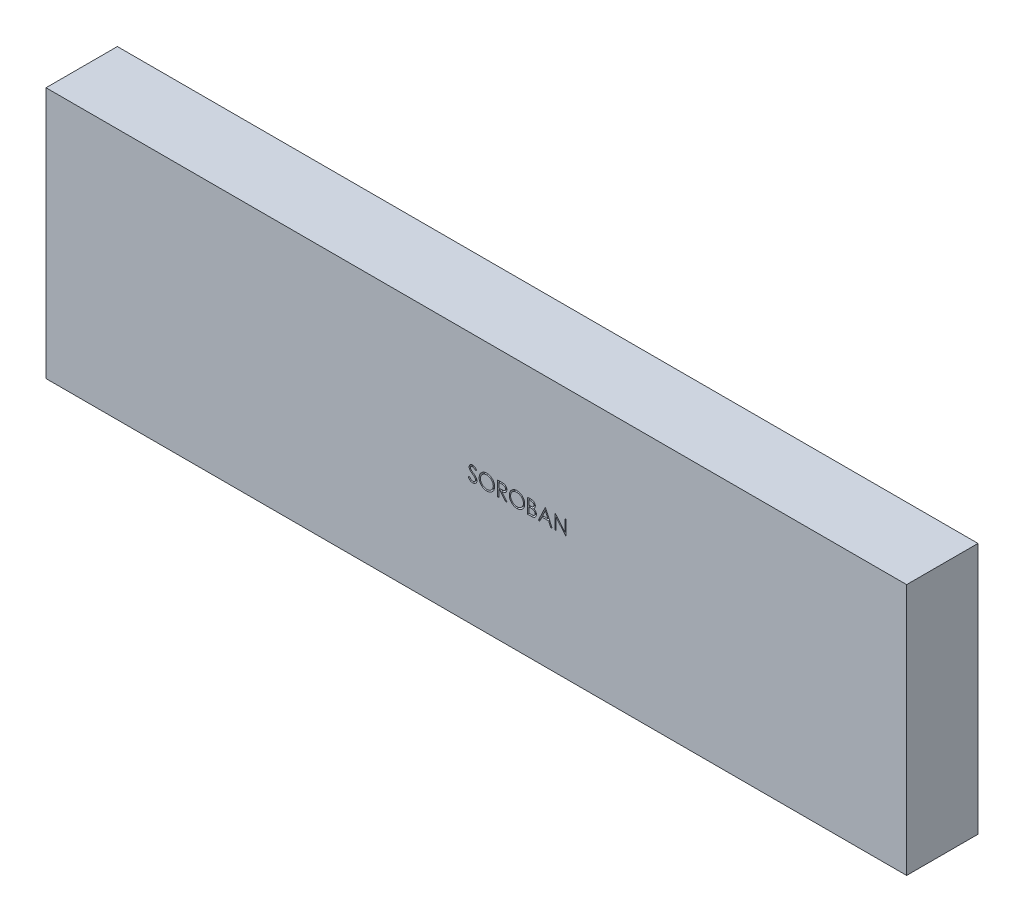
from build123d import *

# Parameters (mm, degrees)
SKETCH_1_W          = 205
SKETCH_1_H          = 60
EXTRUDE_1_DEPTH     = 17
CUT_EXTRUDE_1_DEPTH = 5


with BuildPart() as part:
    # ｽｹｯﾁ1 → ﾎﾞｽ - 押し出し1 (new body)
    with BuildSketch(Plane.XY):
        Rectangle(SKETCH_1_W, SKETCH_1_H)
    extrude(amount=EXTRUDE_1_DEPTH)

    # ｽｹｯﾁ2 → ｶｯﾄ - 押し出し1 (cut)
    # profile 1 of 7: a face of its own
    with BuildSketch(Plane.XY.offset(17)):
        with BuildLine():
            Line((-1.927918922, 0.065725559), (-1.632045525, 0.243109374))
            add(Edge.make_bspline(
                [(-1.632045525, 0.243109374), (-1.604527288, 0.197044989), (-1.551803407, 0.108787405), (-1.463852048, -0.010470636), (-1.372719137, -0.111832793), (-1.277729803, -0.1947094), (-1.179463855, -0.259958287), (-1.077279801, -0.306160519), (-0.971521991, -0.334976494), (-0.899548169, -0.33847658), (-0.863616038, -0.34022396)],
                knots=[0, 0, 0, 0, 1.272034388, 2.437168799, 3.508375237, 4.49857839, 5.41946034, 6.295179144, 7.148887113, 8, 8, 8, 8], degree=3))
            add(Edge.make_bspline(
                [(-0.863616038, -0.34022396), (-0.832929177, -0.339369287), (-0.772092404, -0.337674897), (-0.682530161, -0.321394095), (-0.595548359, -0.296381966), (-0.512939721, -0.260561035), (-0.435844107, -0.217222549), (-0.368237411, -0.164876371), (-0.309791298, -0.106270166), (-0.261982184, -0.040887511), (-0.225302148, 0.029429638), (-0.19711008, 0.101605589), (-0.181465006, 0.176774157), (-0.179108253, 0.22738462), (-0.177918922, 0.252925079)],
                knots=[0, 0, 0, 0, 1.095163259, 2.171163733, 3.241058638, 4.321873601, 5.38011039, 6.391990106, 7.366004449, 8.327778327, 9.272591725, 10.192022065, 11.087607919, 12, 12, 12, 12], degree=3))
            add(Edge.make_bspline(
                [(-0.177918922, 0.252925079), (-0.179393233, 0.282065928), (-0.182390291, 0.341305018), (-0.207721771, 0.42870467), (-0.247571018, 0.51519724), (-0.284333662, 0.568698506), (-0.303419724, 0.596474758)],
                knots=[0, 0, 0, 0, 0.938893495, 1.908633276, 2.914225137, 4, 4, 4, 4], degree=3))
            add(Edge.make_bspline(
                [(-0.303419724, 0.596474758), (-0.319090338, 0.616521582), (-0.351988832, 0.65860738), (-0.408546345, 0.721252616), (-0.474912459, 0.785871035), (-0.548816014, 0.854930092), (-0.632949103, 0.925217888), (-0.724676617, 1.000086166), (-0.826340476, 1.076687743), (-0.897639973, 1.128060309), (-0.934429339, 1.154567707)],
                knots=[0, 0, 0, 0, 0.722233717, 1.516239348, 2.393582979, 3.351407094, 4.387010283, 5.505090956, 6.712668013, 8, 8, 8, 8], degree=3))
            add(Edge.make_bspline(
                [(-0.934429339, 1.154567707), (-0.971253335, 1.180796294), (-1.041658012, 1.230943357), (-1.140116594, 1.305367641), (-1.228161057, 1.37341151), (-1.305400074, 1.435715522), (-1.371799671, 1.492288127), (-1.427883082, 1.542586066), (-1.472221639, 1.587969627), (-1.496877219, 1.617410969), (-1.507946967, 1.630629406)],
                knots=[0, 0, 0, 0, 1.452282411, 2.77665338, 3.964542531, 5.026858415, 5.96415736, 6.766646006, 7.446254459, 8, 8, 8, 8], degree=3))
            add(Edge.make_bspline(
                [(-1.507946967, 1.630629406), (-1.523419513, 1.651230442), (-1.553848349, 1.691745146), (-1.594014355, 1.755070004), (-1.628153518, 1.819893269), (-1.65491585, 1.886389134), (-1.677452069, 1.953624063), (-1.692609999, 2.022475309), (-1.702101396, 2.092633927), (-1.703073383, 2.139847428), (-1.703559948, 2.16348197)],
                knots=[0, 0, 0, 0, 1.068054152, 2.10047183, 3.106115577, 4.101338837, 5.06977816, 6.043150881, 7.020423561, 8, 8, 8, 8], degree=3))
            add(Edge.make_bspline(
                [(-1.703559948, 2.16348197), (-1.702254739, 2.200511744), (-1.699672219, 2.273779808), (-1.677831702, 2.380810638), (-1.643358808, 2.482997056), (-1.59506392, 2.579327389), (-1.532806567, 2.66729337), (-1.460760593, 2.747906857), (-1.374949107, 2.815675439), (-1.280796483, 2.874887498), (-1.177740111, 2.921233423), (-1.069749208, 2.956194403), (-0.956652136, 2.976003661), (-0.880049001, 2.978846426), (-0.84118014, 2.980288861)],
                knots=[0, 0, 0, 0, 1.005424448, 1.989358655, 2.955360095, 3.929531133, 4.905563448, 5.876582895, 6.856512386, 7.866279853, 8.892233794, 9.918561126, 10.94386622, 12, 12, 12, 12], degree=3))
            add(Edge.make_bspline(
                [(-0.84118014, 2.980288861), (-0.79993604, 2.978866309), (-0.717914688, 2.976037308), (-0.597265473, 2.951439777), (-0.481104756, 2.910739105), (-0.387661492, 2.864550447), (-0.31452873, 2.818419031), (-0.258755997, 2.776399207), (-0.202238547, 2.728024098), (-0.144520492, 2.673164852), (-0.086579832, 2.611318101), (-0.02755638, 2.542907412), (0.032687889, 2.468350856), (0.071443749, 2.415126356), (0.091311847, 2.387840944)],
                knots=[0, 0, 0, 0, 1.286793592, 2.559021753, 3.825965368, 5.121522368, 5.803751409, 6.523245864, 7.299691795, 8.125521123, 9.008227632, 9.944561021, 10.946284179, 12, 12, 12, 12], degree=3))
            Line((0.091311847, 2.387840944), (-0.19264248, 2.172596553))
            add(Edge.make_bspline(
                [(-0.19264248, 2.172596553), (-0.209788413, 2.194685243), (-0.24280747, 2.237222897), (-0.292936957, 2.296794212), (-0.340185604, 2.351210692), (-0.386736004, 2.39847582), (-0.430129636, 2.441177953), (-0.472246678, 2.47773771), (-0.512481029, 2.508513305), (-0.56319794, 2.541356865), (-0.626915658, 2.573913369), (-0.706900194, 2.601462447), (-0.790486469, 2.618017509), (-0.847416101, 2.620206397), (-0.87623623, 2.621314502)],
                knots=[0, 0, 0, 0, 1.181633172, 2.275549214, 3.290209073, 4.226197932, 5.078386478, 5.862611352, 6.581680152, 7.217281963, 8.414376989, 9.595101626, 10.782541182, 12, 12, 12, 12], degree=3))
            add(Edge.make_bspline(
                [(-0.87623623, 2.621314502), (-0.912392753, 2.620102802), (-0.9821172, 2.617766153), (-1.081107436, 2.592246167), (-1.170201361, 2.552064307), (-1.246753926, 2.495749329), (-1.310490903, 2.429028336), (-1.356596362, 2.352249481), (-1.384346527, 2.267467079), (-1.387732806, 2.208325422), (-1.389457384, 2.178205527)],
                knots=[0, 0, 0, 0, 1.14458467, 2.207223713, 3.21896685, 4.227309161, 5.202851033, 6.127160689, 7.046193047, 8, 8, 8, 8], degree=3))
            add(Edge.make_bspline(
                [(-1.389457384, 2.178205527), (-1.389064257, 2.159454049), (-1.388277361, 2.121920429), (-1.377302564, 2.066469007), (-1.363203235, 2.011157668), (-1.340860603, 1.956235085), (-1.310015299, 1.900740726), (-1.269510123, 1.843718989), (-1.218496811, 1.78466728), (-1.179419799, 1.746259906), (-1.158788313, 1.72598197)],
                knots=[0, 0, 0, 0, 0.858281714, 1.717966888, 2.583508476, 3.4729293, 4.427298488, 5.488583878, 6.674047936, 8, 8, 8, 8], degree=3))
            add(Edge.make_bspline(
                [(-1.158788313, 1.72598197), (-1.151126941, 1.719144944), (-1.132925274, 1.702901736), (-1.099649348, 1.676309455), (-1.05570655, 1.643506683), (-1.002244349, 1.602919366), (-0.938276987, 1.555837904), (-0.863797431, 1.502864292), (-0.779635898, 1.442278833), (-0.719913982, 1.399921292), (-0.688335589, 1.377524438)],
                knots=[0, 0, 0, 0, 0.420754252, 0.999615792, 1.744751191, 2.668019286, 3.750313428, 4.999500688, 6.413464383, 8, 8, 8, 8], degree=3))
            add(Edge.make_bspline(
                [(-0.688335589, 1.377524438), (-0.650349676, 1.349883078), (-0.576795219, 1.296359416), (-0.47213764, 1.215943736), (-0.377243831, 1.137295968), (-0.291780628, 1.060918361), (-0.214903719, 0.987390268), (-0.147465999, 0.915827087), (-0.088780318, 0.846741515), (-0.0256011, 0.758168939), (0.03895672, 0.649387855), (0.094398227, 0.516109616), (0.129356574, 0.382313296), (0.13392809, 0.292386459), (0.136183642, 0.248017226)],
                knots=[0, 0, 0, 0, 1.163667725, 2.253281268, 3.268753668, 4.215851969, 5.092017293, 5.902905408, 6.650798638, 7.335211899, 8.59617414, 9.77448103, 10.901945474, 12, 12, 12, 12], degree=3))
            add(Edge.make_bspline(
                [(0.136183642, 0.248017226), (0.135526504, 0.216638861), (0.134224988, 0.154491477), (0.119264075, 0.063236401), (0.09734441, -0.025394469), (0.064307176, -0.110305582), (0.023984017, -0.193050344), (-0.027182231, -0.271458245), (-0.086489915, -0.347264643), (-0.15452368, -0.418448135), (-0.228969583, -0.483794331), (-0.307653277, -0.541923392), (-0.39070355, -0.590391715), (-0.477669867, -0.629942557), (-0.568572203, -0.660876075), (-0.663379987, -0.683288944), (-0.762249499, -0.697044655), (-0.82944998, -0.698472417), (-0.863616038, -0.699198319)],
                knots=[0, 0, 0, 0, 0.983748083, 1.948392443, 2.894712957, 3.844097841, 4.80183111, 5.778335162, 6.776009319, 7.81870978, 8.863265674, 9.881300176, 10.883814829, 11.87499822, 12.874611388, 13.892143829, 14.928324115, 16, 16, 16, 16], degree=3))
            add(Edge.make_bspline(
                [(-0.863616038, -0.699198319), (-0.890051381, -0.698687137), (-0.942589141, -0.697671212), (-1.020298623, -0.688689931), (-1.096438212, -0.675982828), (-1.170052494, -0.655808758), (-1.242089906, -0.631331781), (-1.31223714, -0.601193448), (-1.380528194, -0.565076247), (-1.447345777, -0.523781222), (-1.512519951, -0.475723478), (-1.575439419, -0.419749981), (-1.638168605, -0.357404476), (-1.698856001, -0.286993913), (-1.758729146, -0.20965583), (-1.816607555, -0.124666646), (-1.873689273, -0.032489293), (-1.909504741, 0.032375793), (-1.927918922, 0.065725559)],
                knots=[0, 0, 0, 0, 0.915332311, 1.819136955, 2.706846663, 3.586547465, 4.459518054, 5.340707479, 6.227863349, 7.133153174, 8.059268498, 9.028702269, 10.047606654, 11.120612155, 12.245963614, 13.433783089, 14.680604001, 16, 16, 16, 16], degree=3))
        make_face()
    # profile 2 of 7: a face of its own
    with BuildSketch(Plane.XY.offset(17)):
        with BuildLine():
            add(Edge.make_bspline(
                [(2.491952872, 2.980288861), (2.556760978, 2.978647381), (2.684049445, 2.97542338), (2.871124343, 2.950744277), (3.049719438, 2.908048887), (3.221289577, 2.851185904), (3.383782554, 2.775331519), (3.538421446, 2.683646371), (3.68483832, 2.575169912), (3.821059702, 2.450740685), (3.945716652, 2.315357231), (4.055542538, 2.170879321), (4.147584832, 2.018180519), (4.223170619, 1.857719688), (4.282469229, 1.68985972), (4.323388272, 1.513705717), (4.349526423, 1.330399027), (4.3525822, 1.205372163), (4.35413236, 1.141947515)],
                knots=[0, 0, 0, 0, 1.065120563, 2.091984664, 3.0946048, 4.079830382, 5.057816894, 6.036188127, 7.030412546, 8.04752943, 9.064399622, 10.05169764, 11.02544977, 11.989514704, 12.962713494, 13.945757189, 14.957906945, 16, 16, 16, 16], degree=3))
            add(Edge.make_bspline(
                [(4.35413236, 1.141947515), (4.352582427, 1.078990068), (4.349527331, 0.954893648), (4.323358553, 0.772750204), (4.282317553, 0.597659507), (4.223721287, 0.429913854), (4.148495808, 0.269336291), (4.055840637, 0.116349337), (3.946699426, -0.029097162), (3.822492575, -0.165409827), (3.687091533, -0.290407298), (3.541861267, -0.399326173), (3.390067947, -0.493050298), (3.229758239, -0.567833972), (3.063058202, -0.627605892), (2.888475879, -0.668358522), (2.706829325, -0.694645566), (2.582958321, -0.697664082), (2.519997744, -0.699198319)],
                knots=[0, 0, 0, 0, 1.043624062, 2.057103931, 3.04512605, 4.022047818, 4.998200453, 5.980619268, 6.982898556, 8.009068085, 9.034988726, 10.034168286, 11.015286542, 11.987931943, 12.962482838, 13.94673481, 14.956375938, 16, 16, 16, 16], degree=3))
            add(Edge.make_bspline(
                [(2.519997744, -0.699198319), (2.456573425, -0.697648932), (2.331547209, -0.694594678), (2.148010174, -0.668413273), (1.97173243, -0.627471969), (1.803218079, -0.568962533), (1.642373149, -0.493345302), (1.488883067, -0.401140923), (1.343363919, -0.291733782), (1.207022173, -0.167567208), (1.082272975, -0.032395656), (0.973513599, 0.112438599), (0.881288486, 0.264094056), (0.805925153, 0.42299158), (0.746260694, 0.588363023), (0.705555876, 0.7613115), (0.679219924, 0.940851006), (0.676185077, 1.063093905), (0.67464518, 1.125120591)],
                knots=[0, 0, 0, 0, 1.053102029, 2.075944431, 3.073151272, 4.055350789, 5.033113405, 6.020478099, 7.024410459, 8.052272461, 9.079885166, 10.07527673, 11.055994387, 12.023226415, 12.992069828, 13.970394897, 14.97016774, 16, 16, 16, 16], degree=3))
            add(Edge.make_bspline(
                [(0.67464518, 1.125120591), (0.675179816, 1.166753261), (0.676242342, 1.249493384), (0.689034034, 1.372359984), (0.707595736, 1.493250642), (0.734197648, 1.61182159), (0.768989315, 1.727782575), (0.810041343, 1.841933338), (0.860181188, 1.953117061), (0.916861836, 2.061860453), (0.980123644, 2.166468359), (1.049999393, 2.265347942), (1.124034762, 2.359328939), (1.205198156, 2.445975943), (1.290814601, 2.527809599), (1.382272979, 2.603572316), (1.479015223, 2.673947267), (1.581457603, 2.737367608), (1.687075878, 2.794726743), (1.795952656, 2.843948594), (1.906609227, 2.886194655), (2.019563875, 2.92043548), (2.134516647, 2.947467516), (2.251718432, 2.96587487), (2.371075858, 2.978699188), (2.451487177, 2.97975669), (2.491952872, 2.980288861)],
                knots=[0, 0, 0, 0, 1.037015668, 2.060948919, 3.074880161, 4.083647147, 5.086022904, 6.090072063, 7.104153813, 8.122640571, 9.144368836, 10.147691507, 11.138137339, 12.123020368, 13.103399296, 14.087645067, 15.080126199, 16.082011238, 17.087798457, 18.072939717, 19.057185487, 20.037253025, 21.01195951, 21.997135196, 22.992090687, 24, 24, 24, 24], degree=3))
        make_face()
        with BuildLine():
            add(Edge.make_bspline(
                [(2.507377552, 2.621314502), (2.474162918, 2.620909611), (2.408051185, 2.620103702), (2.309766649, 2.609487986), (2.212774715, 2.594358097), (2.117055353, 2.572776576), (2.023009064, 2.543372524), (1.929759223, 2.509531615), (1.838156169, 2.468310525), (1.748502311, 2.421737821), (1.661587236, 2.3701889), (1.579574534, 2.313217133), (1.50225189, 2.252158578), (1.429808624, 2.186870741), (1.362457452, 2.117021139), (1.29887275, 2.043668703), (1.241603168, 1.964716812), (1.189117592, 1.882306405), (1.142149751, 1.796544824), (1.100384397, 1.708334962), (1.066220388, 1.616957275), (1.038358012, 1.523403117), (1.015258201, 1.427820658), (1.000624277, 1.329484809), (0.989891917, 1.228889697), (0.989132072, 1.160907843), (0.988747744, 1.126522835)],
                knots=[0, 0, 0, 0, 1.008559885, 2.007477868, 2.99961109, 3.989939068, 4.984837346, 5.991145699, 7.001802488, 8.033829008, 9.059044045, 10.069351652, 11.065060232, 12.050310815, 13.029377138, 14.011219647, 14.996725999, 15.989392538, 16.977580475, 17.965360261, 18.951710183, 19.937753436, 20.929683414, 21.935841486, 22.955955122, 24, 24, 24, 24], degree=3))
            add(Edge.make_bspline(
                [(0.988747744, 1.126522835), (0.990022606, 1.075960614), (0.992530654, 0.976489084), (1.014488224, 0.83072094), (1.048310199, 0.690632654), (1.098167565, 0.556990744), (1.16051818, 0.428646462), (1.23754507, 0.306738357), (1.328804156, 0.191233483), (1.432467682, 0.082938214), (1.545790389, -0.015907591), (1.666123119, -0.102670999), (1.792176726, -0.176081249), (1.924279929, -0.235886321), (2.061727468, -0.283276059), (2.205405019, -0.31575469), (2.354355479, -0.337130146), (2.455886134, -0.339182902), (2.507377552, -0.34022396)],
                knots=[0, 0, 0, 0, 1.032063989, 2.030389145, 3.003944642, 3.970395727, 4.937377036, 5.913328081, 6.909231446, 7.93887556, 8.970685674, 9.976071282, 10.964166581, 11.944589148, 12.933237628, 13.927779006, 14.949070134, 16, 16, 16, 16], degree=3))
            add(Edge.make_bspline(
                [(2.507377552, -0.34022396), (2.541987054, -0.339748455), (2.61062809, -0.338805387), (2.712723612, -0.329306711), (2.812979824, -0.314074841), (2.911256104, -0.292144186), (3.007440915, -0.264696979), (3.101935718, -0.232089251), (3.193734009, -0.191408048), (3.283993846, -0.146460096), (3.370390088, -0.095219938), (3.45286562, -0.040181789), (3.5293416, 0.020786832), (3.601730672, 0.085104644), (3.669358361, 0.154068492), (3.731767345, 0.227588714), (3.788747477, 0.306129371), (3.841213124, 0.388414777), (3.888016386, 0.47441103), (3.928795486, 0.562940708), (3.963391601, 0.653785817), (3.991320106, 0.747077389), (4.013205568, 0.842638237), (4.028285488, 0.940596316), (4.038833926, 1.040755658), (4.039629004, 1.108499514), (4.040029796, 1.142648636)],
                knots=[0, 0, 0, 0, 1.047197238, 2.076906641, 3.100256066, 4.114471768, 5.12198147, 6.126382909, 7.136867548, 8.15857795, 9.17633901, 10.174870724, 11.156907918, 12.133735059, 13.104061851, 14.077631395, 15.04955518, 16.038496417, 17.029181396, 18.010275684, 18.986308667, 19.968651475, 20.955262928, 21.950658345, 22.966943676, 24, 24, 24, 24], degree=3))
            add(Edge.make_bspline(
                [(4.040029796, 1.142648636), (4.039628683, 1.176564141), (4.038833001, 1.243841791), (4.028290526, 1.343302609), (4.013189636, 1.440555821), (3.991426928, 1.535219624), (3.963376774, 1.627318149), (3.928789444, 1.716764896), (3.888004144, 1.803893091), (3.84119592, 1.888487388), (3.788580097, 1.969662126), (3.731085853, 2.047264539), (3.667720505, 2.11983728), (3.60029448, 2.189171974), (3.527123595, 2.253789864), (3.448539301, 2.313712385), (3.365495623, 2.370385659), (3.277568388, 2.421511221), (3.186824434, 2.468725453), (3.093710476, 2.509176457), (2.999281376, 2.543548576), (2.903777264, 2.572865541), (2.806394286, 2.594273571), (2.707790457, 2.609501621), (2.608102198, 2.620100007), (2.541058978, 2.620908385), (2.507377552, 2.621314502)],
                knots=[0, 0, 0, 0, 1.02996197, 2.043119294, 3.035359645, 4.018872909, 4.991431989, 5.957985074, 6.929999688, 7.912076566, 8.892894881, 9.867085534, 10.843653904, 11.817741046, 12.803660682, 13.806313499, 14.818574707, 15.856120519, 16.894564902, 17.924820532, 18.937903209, 19.946497019, 20.957711757, 21.963978472, 22.977135795, 24, 24, 24, 24], degree=3))
        make_face(mode=Mode.SUBTRACT)
    # profile 3 of 7: a face of its own
    with BuildSketch(Plane.XY.offset(17)):
        with BuildLine():
            Line((5.072081078, 2.890545271), (5.772501751, 2.890545271))
            add(Edge.make_bspline(
                [(5.772501751, 2.890545271), (5.819242879, 2.890389685), (5.908991024, 2.890090943), (6.037564294, 2.88842518), (6.154391391, 2.883650824), (6.25941123, 2.879542241), (6.352621885, 2.872050299), (6.434309176, 2.864889652), (6.504096873, 2.855515991), (6.546342725, 2.846810568), (6.565470501, 2.842868989)],
                knots=[0, 0, 0, 0, 1.410062039, 2.707475311, 3.878576406, 4.937260626, 5.877586885, 6.699081471, 7.410979367, 8, 8, 8, 8], degree=3))
            add(Edge.make_bspline(
                [(6.565470501, 2.842868989), (6.591077125, 2.836542224), (6.641744114, 2.82402366), (6.71469418, 2.797564059), (6.784208504, 2.766944434), (6.849998329, 2.730980714), (6.91173412, 2.689405934), (6.970052431, 2.642937812), (7.025217894, 2.591830606), (7.074999524, 2.534795765), (7.121938576, 2.474959255), (7.161527202, 2.410255498), (7.195653682, 2.342593971), (7.222824199, 2.271286553), (7.244702172, 2.197024781), (7.260128412, 2.119135984), (7.269379599, 2.037975009), (7.270321455, 1.9826171), (7.270799026, 1.954547675)],
                knots=[0, 0, 0, 0, 1.027469482, 2.033020251, 3.019912614, 3.986113645, 4.951240523, 5.91722682, 6.890402269, 7.87763091, 8.8651537, 9.85103654, 10.82876324, 11.815024772, 12.821070561, 13.842952187, 14.906261191, 16, 16, 16, 16], degree=3))
            add(Edge.make_bspline(
                [(7.270799026, 1.954547675), (7.269330028, 1.90791257), (7.266463632, 1.816915402), (7.239738529, 1.684854521), (7.195962009, 1.561665206), (7.13563872, 1.447502568), (7.058819244, 1.344591923), (6.966494453, 1.254201468), (6.858612842, 1.178561555), (6.758183526, 1.12610875), (6.669469326, 1.092515842), (6.596436013, 1.068879483), (6.516769036, 1.050617518), (6.431231701, 1.034257386), (6.339468046, 1.021905691), (6.241698006, 1.012859097), (6.137851855, 1.007205048), (6.066512785, 1.006363043), (6.029813449, 1.005929886)],
                knots=[0, 0, 0, 0, 1.260483769, 2.459530307, 3.627416485, 4.787058657, 5.939039949, 7.08810263, 8.267026773, 9.491475466, 10.141966685, 10.831826277, 11.566392101, 12.351337768, 13.187381173, 14.07005841, 15.007169909, 16, 16, 16, 16], degree=3))
            Line((6.029813449, 1.005929886), (7.315670821, -0.609454729))
            Line((7.315670821, -0.609454729), (6.927249347, -0.609454729))
            Line((6.927249347, -0.609454729), (5.641391975, 1.005929886))
            Line((5.641391975, 1.005929886), (5.386183642, 1.005929886))
            Line((5.386183642, 1.005929886), (5.386183642, -0.609454729))
            Line((5.386183642, -0.609454729), (5.072081078, -0.609454729))
            Line((5.072081078, -0.609454729), (5.072081078, 2.890545271))
        make_face()
        with BuildLine():
            Line((5.386183642, 2.531570912), (5.386183642, 1.364904245))
            Line((5.386183642, 1.364904245), (6.027008962, 1.359996393))
            add(Edge.make_bspline(
                [(6.027008962, 1.359996393), (6.056929001, 1.359983156), (6.114922558, 1.3599575), (6.198823223, 1.363951276), (6.276943335, 1.368494594), (6.348984087, 1.37544394), (6.414977662, 1.384400011), (6.474891075, 1.395602996), (6.528822127, 1.408655058), (6.591720666, 1.428856684), (6.661957197, 1.460862702), (6.738288657, 1.507428201), (6.803290995, 1.56599732), (6.858208857, 1.632970776), (6.902338289, 1.706607025), (6.933450343, 1.786023394), (6.953192785, 1.869214992), (6.955521331, 1.9263931), (6.956696462, 1.955248797)],
                knots=[0, 0, 0, 0, 1.146690395, 2.22261258, 3.21895312, 4.145990853, 4.996080663, 5.770904154, 6.481378293, 7.121626537, 8.300444488, 9.431385265, 10.535395872, 11.636531494, 12.74115979, 13.810798291, 14.895190096, 16, 16, 16, 16], degree=3))
            add(Edge.make_bspline(
                [(6.956696462, 1.955248797), (6.955494341, 1.98339537), (6.953112176, 2.039171609), (6.933663407, 2.120827519), (6.900774026, 2.197894469), (6.856451788, 2.270058954), (6.802452633, 2.33556469), (6.73913482, 2.391611843), (6.668229625, 2.437861308), (6.601958427, 2.467415689), (6.542724214, 2.485535542), (6.491294554, 2.498286706), (6.433183077, 2.508531175), (6.368107618, 2.516739235), (6.296345987, 2.52379418), (6.217535336, 2.528545958), (6.132198556, 2.531359822), (6.073051625, 2.531498911), (6.042433642, 2.531570912)],
                knots=[0, 0, 0, 0, 1.101028733, 2.181837193, 3.264309656, 4.369019818, 5.486613113, 6.575447106, 7.666700264, 8.788928104, 9.402425223, 10.0903467, 10.862060571, 11.710948788, 12.657782767, 13.684531032, 14.801375019, 16, 16, 16, 16], degree=3))
            Line((6.042433642, 2.531570912), (5.386183642, 2.531570912))
        make_face(mode=Mode.SUBTRACT)
    # profile 4 of 7: a face of its own
    with BuildSketch(Plane.XY.offset(17)):
        with BuildLine():
            add(Edge.make_bspline(
                [(9.671440052, 2.980288861), (9.736248158, 2.978647381), (9.863536625, 2.97542338), (10.050611523, 2.950744277), (10.229206618, 2.908048887), (10.400776757, 2.851185904), (10.563269733, 2.775331519), (10.717908626, 2.683646371), (10.864325499, 2.575169912), (11.000546881, 2.450740685), (11.125203831, 2.315357231), (11.235029718, 2.170879321), (11.327072011, 2.018180519), (11.402657798, 1.857719688), (11.461956408, 1.68985972), (11.502875452, 1.513705717), (11.529013602, 1.330399027), (11.532069379, 1.205372163), (11.533619539, 1.141947515)],
                knots=[0, 0, 0, 0, 1.065120563, 2.091984664, 3.0946048, 4.079830382, 5.057816894, 6.036188127, 7.030412546, 8.04752943, 9.064399622, 10.05169764, 11.02544977, 11.989514704, 12.962713494, 13.945757189, 14.957906945, 16, 16, 16, 16], degree=3))
            add(Edge.make_bspline(
                [(11.533619539, 1.141947515), (11.532069607, 1.078990068), (11.52901451, 0.954893648), (11.502845732, 0.772750204), (11.461804732, 0.597659507), (11.403208466, 0.429913854), (11.327982988, 0.269336291), (11.235327817, 0.116349337), (11.126186606, -0.029097162), (11.001979755, -0.165409827), (10.866578713, -0.290407298), (10.721348446, -0.399326173), (10.569555126, -0.493050298), (10.409245418, -0.567833972), (10.242545381, -0.627605892), (10.067963058, -0.668358522), (9.886316504, -0.694645566), (9.7624455, -0.697664082), (9.699484924, -0.699198319)],
                knots=[0, 0, 0, 0, 1.043624062, 2.057103931, 3.04512605, 4.022047818, 4.998200453, 5.980619268, 6.982898556, 8.009068085, 9.034988726, 10.034168286, 11.015286542, 11.987931943, 12.962482838, 13.94673481, 14.956375938, 16, 16, 16, 16], degree=3))
            add(Edge.make_bspline(
                [(9.699484924, -0.699198319), (9.636060605, -0.697648932), (9.511034389, -0.694594678), (9.327497353, -0.668413273), (9.15121961, -0.627471969), (8.982705258, -0.568962533), (8.821860329, -0.493345302), (8.668370246, -0.401140923), (8.522851099, -0.291733782), (8.386509352, -0.167567208), (8.261760154, -0.032395656), (8.153000778, 0.112438599), (8.060775665, 0.264094056), (7.985412333, 0.42299158), (7.925747873, 0.588363023), (7.885043055, 0.7613115), (7.858707103, 0.940851006), (7.855672257, 1.063093905), (7.85413236, 1.125120591)],
                knots=[0, 0, 0, 0, 1.053102029, 2.075944431, 3.073151272, 4.055350789, 5.033113405, 6.020478099, 7.024410459, 8.052272461, 9.079885166, 10.07527673, 11.055994387, 12.023226415, 12.992069828, 13.970394897, 14.97016774, 16, 16, 16, 16], degree=3))
            add(Edge.make_bspline(
                [(7.85413236, 1.125120591), (7.854666995, 1.166753261), (7.855729521, 1.249493384), (7.868521214, 1.372359984), (7.887082915, 1.493250642), (7.913684828, 1.61182159), (7.948476495, 1.727782575), (7.989528522, 1.841933338), (8.039668367, 1.953117061), (8.096349015, 2.061860453), (8.159610823, 2.166468359), (8.229486573, 2.265347942), (8.303521941, 2.359328939), (8.384685335, 2.445975943), (8.47030178, 2.527809599), (8.561760158, 2.603572316), (8.658502403, 2.673947267), (8.760944782, 2.737367608), (8.866563057, 2.794726743), (8.975439835, 2.843948594), (9.086096407, 2.886194655), (9.199051055, 2.92043548), (9.314003827, 2.947467516), (9.431205611, 2.96587487), (9.550563038, 2.978699188), (9.630974356, 2.97975669), (9.671440052, 2.980288861)],
                knots=[0, 0, 0, 0, 1.037015668, 2.060948919, 3.074880161, 4.083647147, 5.086022904, 6.090072063, 7.104153813, 8.122640571, 9.144368836, 10.147691507, 11.138137339, 12.123020368, 13.103399296, 14.087645067, 15.080126199, 16.082011238, 17.087798457, 18.072939717, 19.057185487, 20.037253025, 21.01195951, 21.997135196, 22.992090687, 24, 24, 24, 24], degree=3))
        make_face()
        with BuildLine():
            add(Edge.make_bspline(
                [(9.686864731, 2.621314502), (9.653650098, 2.620909611), (9.587538365, 2.620103702), (9.489253829, 2.609487986), (9.392261895, 2.594358097), (9.296542533, 2.572776576), (9.202496243, 2.543372524), (9.109246402, 2.509531615), (9.017643348, 2.468310525), (8.92798949, 2.421737821), (8.841074415, 2.3701889), (8.759061714, 2.313217133), (8.68173907, 2.252158578), (8.609295803, 2.186870741), (8.541944631, 2.117021139), (8.47835993, 2.043668703), (8.421090348, 1.964716812), (8.368604771, 1.882306405), (8.321636931, 1.796544824), (8.279871576, 1.708334962), (8.245707567, 1.616957275), (8.217845191, 1.523403117), (8.19474538, 1.427820658), (8.180111456, 1.329484809), (8.169379097, 1.228889697), (8.168619251, 1.160907843), (8.168234924, 1.126522835)],
                knots=[0, 0, 0, 0, 1.008559885, 2.007477868, 2.99961109, 3.989939068, 4.984837346, 5.991145699, 7.001802488, 8.033829008, 9.059044045, 10.069351652, 11.065060232, 12.050310815, 13.029377138, 14.011219647, 14.996725999, 15.989392538, 16.977580475, 17.965360261, 18.951710183, 19.937753436, 20.929683414, 21.935841486, 22.955955122, 24, 24, 24, 24], degree=3))
            add(Edge.make_bspline(
                [(8.168234924, 1.126522835), (8.169509786, 1.075960614), (8.172017834, 0.976489084), (8.193975404, 0.83072094), (8.227797378, 0.690632654), (8.277654745, 0.556990744), (8.340005359, 0.428646462), (8.417032249, 0.306738357), (8.508291335, 0.191233483), (8.611954862, 0.082938214), (8.725277568, -0.015907591), (8.845610298, -0.102670999), (8.971663906, -0.176081249), (9.103767108, -0.235886321), (9.241214647, -0.283276059), (9.384892198, -0.31575469), (9.533842658, -0.337130146), (9.635373313, -0.339182902), (9.686864731, -0.34022396)],
                knots=[0, 0, 0, 0, 1.032063989, 2.030389145, 3.003944642, 3.970395727, 4.937377036, 5.913328081, 6.909231446, 7.93887556, 8.970685674, 9.976071282, 10.964166581, 11.944589148, 12.933237628, 13.927779006, 14.949070134, 16, 16, 16, 16], degree=3))
            add(Edge.make_bspline(
                [(9.686864731, -0.34022396), (9.721474233, -0.339748455), (9.790115269, -0.338805387), (9.892210792, -0.329306711), (9.992467003, -0.314074841), (10.090743283, -0.292144186), (10.186928095, -0.264696979), (10.281422898, -0.232089251), (10.373221188, -0.191408048), (10.463481026, -0.146460096), (10.549877268, -0.095219938), (10.6323528, -0.040181789), (10.70882878, 0.020786832), (10.781217851, 0.085104644), (10.84884554, 0.154068492), (10.911254524, 0.227588714), (10.968234657, 0.306129371), (11.020700303, 0.388414777), (11.067503566, 0.47441103), (11.108282665, 0.562940708), (11.142878781, 0.653785817), (11.170807286, 0.747077389), (11.192692747, 0.842638237), (11.207772667, 0.940596316), (11.218321106, 1.040755658), (11.219116183, 1.108499514), (11.219516975, 1.142648636)],
                knots=[0, 0, 0, 0, 1.047197238, 2.076906641, 3.100256066, 4.114471768, 5.12198147, 6.126382909, 7.136867548, 8.15857795, 9.17633901, 10.174870724, 11.156907918, 12.133735059, 13.104061851, 14.077631395, 15.04955518, 16.038496417, 17.029181396, 18.010275684, 18.986308667, 19.968651475, 20.955262928, 21.950658345, 22.966943676, 24, 24, 24, 24], degree=3))
            add(Edge.make_bspline(
                [(11.219516975, 1.142648636), (11.219115862, 1.176564141), (11.218320181, 1.243841791), (11.207777706, 1.343302609), (11.192676816, 1.440555821), (11.170914108, 1.535219624), (11.142863954, 1.627318149), (11.108276623, 1.716764896), (11.067491324, 1.803893091), (11.0206831, 1.888487388), (10.968067276, 1.969662126), (10.910573033, 2.047264539), (10.847207685, 2.11983728), (10.77978166, 2.189171974), (10.706610774, 2.253789864), (10.62802648, 2.313712385), (10.544982803, 2.370385659), (10.457055567, 2.421511221), (10.366311613, 2.468725453), (10.273197655, 2.509176457), (10.178768556, 2.543548576), (10.083264443, 2.572865541), (9.985881465, 2.594273571), (9.887277636, 2.609501621), (9.787589378, 2.620100007), (9.720546158, 2.620908385), (9.686864731, 2.621314502)],
                knots=[0, 0, 0, 0, 1.02996197, 2.043119294, 3.035359645, 4.018872909, 4.991431989, 5.957985074, 6.929999688, 7.912076566, 8.892894881, 9.867085534, 10.843653904, 11.817741046, 12.803660682, 13.806313499, 14.818574707, 15.856120519, 16.894564902, 17.924820532, 18.937903209, 19.946497019, 20.957711757, 21.963978472, 22.977135795, 24, 24, 24, 24], degree=3))
        make_face(mode=Mode.SUBTRACT)
    # profile 5 of 7: a face of its own
    with BuildSketch(Plane.XY.offset(17)):
        with BuildLine():
            Line((12.251568257, 2.890545271), (12.934460885, 2.890545271))
            add(Edge.make_bspline(
                [(12.934460885, 2.890545271), (12.967889363, 2.890369521), (13.032682074, 2.890028873), (13.126901516, 2.884745741), (13.215150326, 2.877542072), (13.297454099, 2.866111979), (13.373774801, 2.852320202), (13.444342438, 2.835618386), (13.50893261, 2.815591772), (13.586045347, 2.783745491), (13.673966008, 2.736422322), (13.7691644, 2.666493757), (13.85056864, 2.580961294), (13.920754957, 2.484478639), (13.976556077, 2.378342867), (14.016925374, 2.265083678), (14.042483249, 2.146161936), (14.045111684, 2.064518758), (14.046440052, 2.023257611)],
                knots=[0, 0, 0, 0, 1.001505555, 1.941167018, 2.826882275, 3.653841531, 4.429895133, 5.150066043, 5.825578002, 6.45369114, 7.647487171, 8.808567382, 9.977351308, 11.170798116, 12.373658725, 13.556498008, 14.765093433, 16, 16, 16, 16], degree=3))
            add(Edge.make_bspline(
                [(14.046440052, 2.023257611), (14.045346833, 1.984605055), (14.043198556, 1.908649138), (14.022655797, 1.797555029), (13.990495128, 1.69180381), (13.945789879, 1.591781424), (13.887687883, 1.499747811), (13.818829564, 1.414960545), (13.735752762, 1.341009488), (13.673509522, 1.299666586), (13.641892776, 1.278666265)],
                knots=[0, 0, 0, 0, 1.044552857, 2.05264487, 3.044412934, 4.028983338, 5.005914585, 5.980388656, 6.974128949, 8, 8, 8, 8], degree=3))
            add(Edge.make_bspline(
                [(13.641892776, 1.278666265), (13.681653204, 1.263401266), (13.757724751, 1.234195541), (13.862410764, 1.182560077), (13.952605609, 1.126397967), (14.029002755, 1.065066117), (14.09434041, 0.998957306), (14.151393351, 0.927102192), (14.200074725, 0.848563434), (14.241787649, 0.764159898), (14.274336405, 0.67475343), (14.298712309, 0.581182654), (14.312679758, 0.483783099), (14.3146674, 0.417497719), (14.315670821, 0.384034854)],
                knots=[0, 0, 0, 0, 1.27268992, 2.434971085, 3.483601985, 4.442670788, 5.356604649, 6.2567628, 7.179492994, 8.113709626, 9.066344395, 10.018646069, 10.999752585, 12, 12, 12, 12], degree=3))
            add(Edge.make_bspline(
                [(14.315670821, 0.384034854), (14.314693975, 0.349867982), (14.312772003, 0.282643704), (14.298592031, 0.18388857), (14.274582924, 0.089513623), (14.241511778, -0.00109156), (14.198349463, -0.087751694), (14.145821499, -0.170564958), (14.083189935, -0.248699289), (14.013127067, -0.323022912), (13.933864921, -0.389850699), (13.848349166, -0.449366406), (13.755502846, -0.498312468), (13.656850852, -0.53942849), (13.551286536, -0.570835688), (13.439283929, -0.592808262), (13.320939627, -0.607613299), (13.239729876, -0.608830504), (13.19808268, -0.609454729)],
                knots=[0, 0, 0, 0, 0.978564426, 1.925352924, 2.850884081, 3.763762016, 4.682927383, 5.618979971, 6.567305752, 7.547517671, 8.540179244, 9.531824382, 10.526200242, 11.540722885, 12.589160233, 13.674978461, 14.80764778, 16, 16, 16, 16], degree=3))
            Line((13.19808268, -0.609454729), (12.251568257, -0.609454729))
            Line((12.251568257, -0.609454729), (12.251568257, 2.890545271))
        make_face()
        with BuildLine():
            Line((12.565670821, 2.531570912), (12.565670821, 1.40977604))
            Line((12.565670821, 1.40977604), (12.776708481, 1.40977604))
            add(Edge.make_bspline(
                [(12.776708481, 1.40977604), (12.807557277, 1.410175963), (12.867163436, 1.410948696), (12.953483333, 1.413162213), (13.033608351, 1.419360256), (13.107400184, 1.425556518), (13.174742628, 1.435631106), (13.235486489, 1.447623229), (13.290585086, 1.460306134), (13.354124632, 1.481875621), (13.42619758, 1.513753296), (13.503030684, 1.563225132), (13.570765154, 1.622149486), (13.627962342, 1.690140447), (13.674773812, 1.765006633), (13.707287527, 1.845553514), (13.729334812, 1.929773646), (13.731326343, 1.987591898), (13.732337488, 2.016947515)],
                knots=[0, 0, 0, 0, 1.156816544, 2.235205308, 3.236616184, 4.169592532, 5.011045266, 5.787822928, 6.49130361, 7.128639758, 8.301311294, 9.436451833, 10.541879658, 11.654887649, 12.756523258, 13.837046038, 14.901820046, 16, 16, 16, 16], degree=3))
            add(Edge.make_bspline(
                [(13.732337488, 2.016947515), (13.731811308, 2.036373286), (13.730779148, 2.074479058), (13.722325845, 2.130028412), (13.707958271, 2.182272165), (13.689503977, 2.231926275), (13.663715289, 2.277438125), (13.633351825, 2.320381321), (13.596666135, 2.35929344), (13.554908822, 2.395662938), (13.5069002, 2.427907466), (13.452668908, 2.456148229), (13.391481231, 2.478889006), (13.324368376, 2.498805158), (13.250297288, 2.512793452), (13.170122735, 2.52444684), (13.083188016, 2.530379582), (13.023042913, 2.531164944), (12.991952872, 2.531570912)],
                knots=[0, 0, 0, 0, 0.91205012, 1.789085906, 2.630437955, 3.453916878, 4.269457761, 5.079663411, 5.91843418, 6.774407191, 7.675494373, 8.627863946, 9.638891023, 10.736472738, 11.911756761, 13.175263542, 14.539845004, 16, 16, 16, 16], degree=3))
            Line((12.991952872, 2.531570912), (12.565670821, 2.531570912))
        make_face(mode=Mode.SUBTRACT)
        with BuildLine():
            Line((12.565670821, 1.050801681), (12.565670821, -0.25048037))
            Line((12.565670821, -0.25048037), (13.012986526, -0.25048037))
            add(Edge.make_bspline(
                [(13.012986526, -0.25048037), (13.045005452, -0.250096623), (13.106717711, -0.249357), (13.195818941, -0.246942446), (13.278402045, -0.24145017), (13.35409018, -0.23280432), (13.423700633, -0.223425871), (13.486398336, -0.21081459), (13.54269153, -0.19636563), (13.607965837, -0.174031457), (13.681469346, -0.139334986), (13.760680202, -0.08702076), (13.83110642, -0.024697452), (13.890911679, 0.047433462), (13.939924668, 0.125864789), (13.975580123, 0.209010139), (13.99757098, 0.295495666), (14.000233149, 0.354462379), (14.001568257, 0.384034854)],
                knots=[0, 0, 0, 0, 1.160039823, 2.235823828, 3.228722157, 4.157150951, 4.99529583, 5.772374946, 6.472645482, 7.099169577, 8.269452708, 9.405989375, 10.527446681, 11.663510218, 12.788923519, 13.866172445, 14.929861265, 16, 16, 16, 16], degree=3))
            add(Edge.make_bspline(
                [(14.001568257, 0.384034854), (14.001292153, 0.402528195), (14.000744398, 0.439216577), (13.992483783, 0.493132396), (13.980469913, 0.545358269), (13.964938479, 0.59603601), (13.942319012, 0.644249386), (13.915912467, 0.690951945), (13.884951065, 0.736205425), (13.836706899, 0.793417678), (13.766534915, 0.859334691), (13.666828139, 0.923872194), (13.553455841, 0.975920001), (13.471228349, 0.998019477), (13.428751751, 1.009435495)],
                knots=[0, 0, 0, 0, 0.723448775, 1.435228256, 2.130040452, 2.821711965, 3.505591119, 4.210454504, 4.921174351, 5.648778258, 7.137944449, 8.670945889, 10.280296675, 12, 12, 12, 12], degree=3))
            add(Edge.make_bspline(
                [(13.428751751, 1.009435495), (13.411722655, 1.012890579), (13.374800062, 1.020381914), (13.314592482, 1.028289617), (13.245856613, 1.035334677), (13.168433736, 1.040545835), (13.082225895, 1.045932378), (12.987048976, 1.0480272), (12.883291661, 1.05052646), (12.811299289, 1.050707594), (12.773903994, 1.050801681)],
                knots=[0, 0, 0, 0, 0.634451884, 1.375622551, 2.216452059, 3.157844607, 4.20941857, 5.370758133, 6.634282058, 8, 8, 8, 8], degree=3))
            Line((12.773903994, 1.050801681), (12.565670821, 1.050801681))
        make_face(mode=Mode.SUBTRACT)
    # profile 6 of 7: a face of its own
    with BuildSketch(Plane.XY.offset(17)):
        Polygon((16.469516975, 2.890545271), (18.08490159, -0.609454729), (17.743455276, -0.609454729), (17.226027392, 0.512340143), (15.63938877, 0.512340143), (15.107237328, -0.609454729), (14.76438877, -0.609454729), (16.42464518, 2.890545271), align=None)
        Polygon((16.443575469, 2.208353765), (15.809761366, 0.871314502), (17.060562648, 0.871314502), align=None, mode=Mode.SUBTRACT)
    # profile 7 of 7: a face of its own
    with BuildSketch(Plane.XY.offset(17)):
        Polygon((18.713106719, -0.609454729), (18.713106719, 2.890545271), (18.779012167, 2.890545271), (21.091311847, 0.135837739), (21.091311847, 2.890545271), (21.405414411, 2.890545271), (21.405414411, -0.609454729), (21.333899988, -0.609454729), (19.027209283, 2.138942707), (19.027209283, -0.609454729), align=None)
    extrude(amount=-CUT_EXTRUDE_1_DEPTH, mode=Mode.SUBTRACT)


solid = part.part
